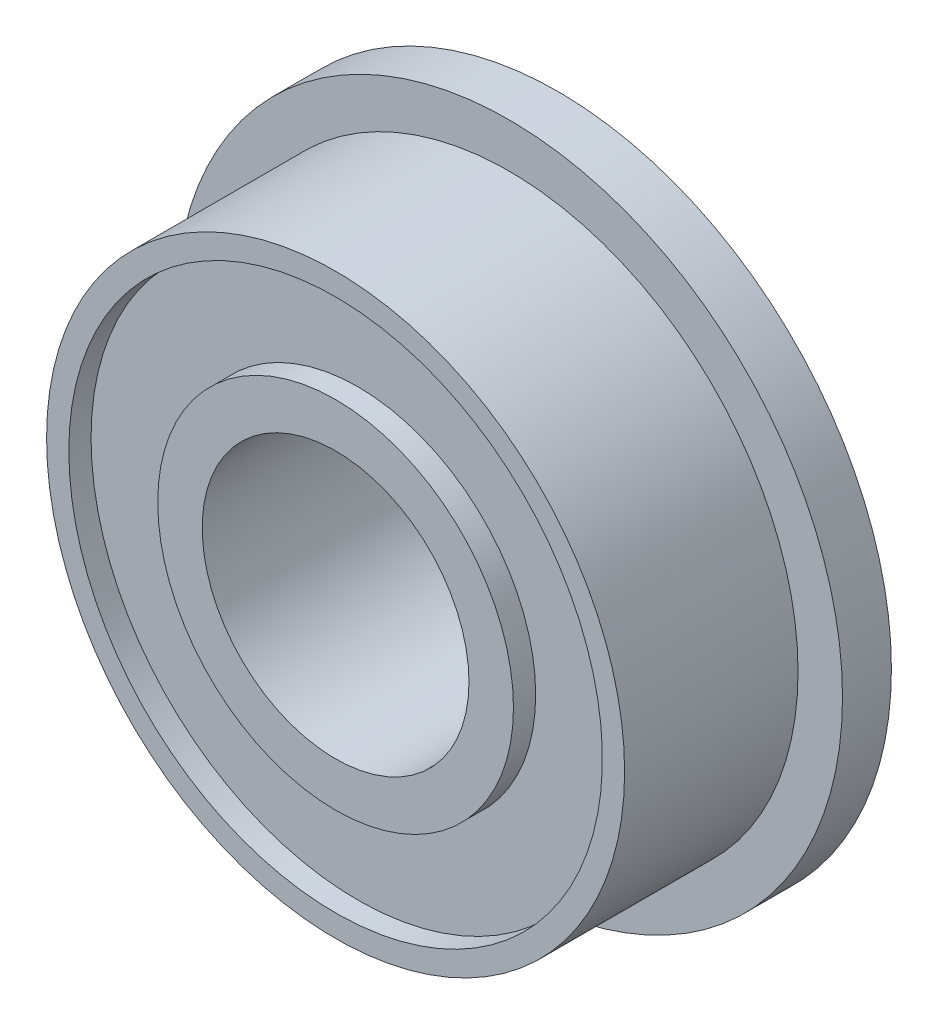
from build123d import *

# Parameters (mm, degrees)
SKETCH1_R           = 7.5
SKETCH1_R_2         = 3
BOSS_EXTRUDE1_DEPTH = 1.1
SKETCH2_R           = 6.5
SKETCH2_R_2         = 3
BOSS_EXTRUDE2_DEPTH = 3.9
SKETCH3_R           = 6
SKETCH3_R_2         = 4
CUT_EXTRUDE1_DEPTH  = 0.5


with BuildPart() as part:
    # Sketch1 → Boss-Extrude1 (new body)
    with BuildSketch(Plane.XY):
        Circle(SKETCH1_R)
        Circle(SKETCH1_R_2, mode=Mode.SUBTRACT)
    extrude(amount=BOSS_EXTRUDE1_DEPTH)

    # Sketch2 → Boss-Extrude2 (add)
    with BuildSketch(Plane.XY.offset(1.1)):
        Circle(SKETCH2_R)
        Circle(SKETCH2_R_2, mode=Mode.SUBTRACT)
    extrude(amount=BOSS_EXTRUDE2_DEPTH)

    # Sketch3 → Cut-Extrude1 (cut)
    with BuildSketch(Plane(origin=(0, 0, 0), x_dir=(-1, 0, 0), z_dir=(0, 0, -1))):
        Circle(SKETCH3_R)
        Circle(SKETCH3_R_2, mode=Mode.SUBTRACT)
    cut_extrude1 = extrude(amount=-CUT_EXTRUDE1_DEPTH, mode=Mode.SUBTRACT)

    # Mirror1: Cut-Extrude1 across plane
    add(cut_extrude1.mirror(Plane.XY.offset(2.5)), mode=Mode.SUBTRACT)


solid = part.part
